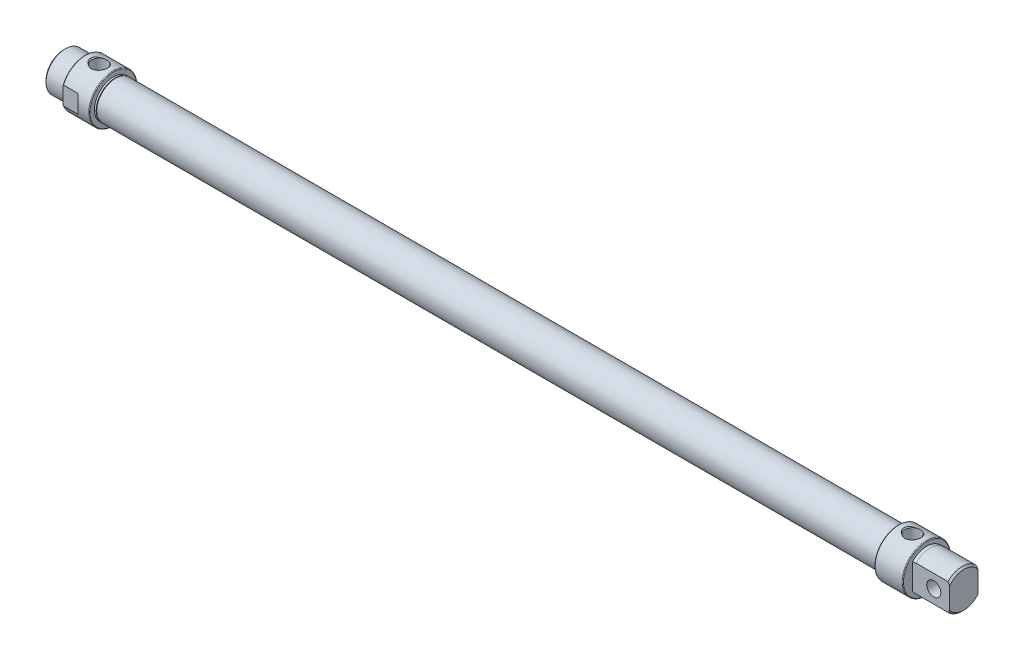
from build123d import *

# Parameters (mm, degrees)
SKETCH_3_W               = 36
SKETCH_3_H               = 42
SKETCH_3_W_2             = 16
SKETCH_3_H_2             = 22
CUT_EXTRUDE_1_DEPTH      = 21
SKETCH_4_W               = 16
SKETCH_4_H               = 4
CUT_EXTRUDE_2_DEPTH      = 27
CUT_EXTRUDE_2_DEPTH_BACK = 27


with BuildPart() as part:
    # 草图1 → 旋转1 (revolve)
    with BuildSketch(Plane.XY):
        with BuildLine():
            Line((0, 0), (0, 10.08))
            Line((0, 10.08), (0.92, 11))
            Line((0.92, 11), (12, 11))
            Line((12, 11), (12, 13.1))
            ThreePointArc((12, 13.1), (12.117157288, 13.382842712), (12.4, 13.5))
            Line((12.4, 13.5), (27.6, 13.5))
            ThreePointArc((27.6, 13.5), (27.882842712, 13.382842712), (28, 13.1))
            Line((28, 13.1), (28, 10.7))
            Line((28, 10.7), (29, 10.7))
            Line((29, 10.7), (29, 10.2))
            Line((29, 10.2), (29.3, 10.7))
            Line((29.3, 10.7), (470.7, 10.7))
            Line((470.7, 10.7), (471, 10.2))
            Line((471, 10.2), (471, 10.7))
            Line((471, 10.7), (472, 10.7))
            Line((472, 10.7), (472, 13.1))
            ThreePointArc((472, 13.1), (472.117157288, 13.382842712), (472.4, 13.5))
            Line((472.4, 13.5), (487.6, 13.5))
            ThreePointArc((487.6, 13.5), (487.882842712, 13.382842712), (488, 13.1))
            Line((488, 13.1), (488, 0))
            Line((488, 0), (0, 0))
        make_face()
    revolve(axis=Axis((488, 0, 0), (-1, 0, 0)))

    # 草图2 → 旋转2 (revolve)
    with BuildSketch(Plane.XY):
        Polygon((488, 0), (488, 10.85), (490, 10.85), (490, 11), (508, 11), (509, 10), (509, 0), align=None)
    revolve(axis=Axis((509, 0, 0), (-1, 0, 0)))

    # 草图3 → 切除-拉伸1 (cut)
    with BuildSketch(Plane(origin=(509, 0, 0), x_dir=(0, 0, -1), z_dir=(1, 0, 0))):
        Rectangle(SKETCH_3_W, SKETCH_3_H)
        Rectangle(SKETCH_3_W_2, SKETCH_3_H_2, mode=Mode.SUBTRACT)
    extrude(amount=-CUT_EXTRUDE_1_DEPTH, mode=Mode.SUBTRACT)

    # 草图4 → 切除-旋转1 (revolve, cut)
    with BuildSketch(Plane(origin=(500, 0, 0), x_dir=(0, 0, -1), z_dir=(1, 0, 0))):
        with Locations((0, 2)):
            Rectangle(SKETCH_4_W, SKETCH_4_H)
    revolve(axis=Axis((500, 0, -8), (0, 0, 1)), mode=Mode.SUBTRACT)

    # 草图5 → 切除-旋转2 (revolve, cut)
    with BuildSketch(Plane.XY):
        Polygon((20, 13.5), (24.864, 13.5), (24.283, 12.919), (24.283, 5.5), (20, 5.5), align=None)
    revolve(axis=Axis((20, 5.5, 0), (0, 1, 0)), mode=Mode.SUBTRACT)

    # 草图6 → 切除-旋转3 (revolve, cut)
    with BuildSketch(Plane.XY):
        Polygon((480, 13.5), (484.864, 13.5), (484.283, 12.919), (484.283, 5.5), (480, 5.5), align=None)
    revolve(axis=Axis((480, 5.5, 0), (0, 1, 0)), mode=Mode.SUBTRACT)

    # 草图7 → 切除-拉伸2 (cut, two sides: drawn at the far end of the back side and taken through both)
    with BuildSketch(Plane(origin=(0, 0, 0), x_dir=(1, 0, 0), z_dir=(0, 1, 0)).offset(-CUT_EXTRUDE_2_DEPTH_BACK)):
        Polygon((-4, -13.5), (21.5, -13.5), (20.5, -12.5), (-2, -12.5), (-2, 12.5), (20.5, 12.5), (21.5, 13.5), (-4, 13.5), align=None)
    extrude(amount=CUT_EXTRUDE_2_DEPTH + CUT_EXTRUDE_2_DEPTH_BACK, mode=Mode.SUBTRACT)

    # 草图8 → 切除-旋转4 (revolve, cut)
    with BuildSketch(Plane.XY):
        Polygon((0, 0), (0, 4), (39, 4), (39, 10), (461, 10), (461, 0), align=None)
    revolve(axis=Axis((461, 0, 0), (-1, 0, 0)), mode=Mode.SUBTRACT)


solid = part.part
